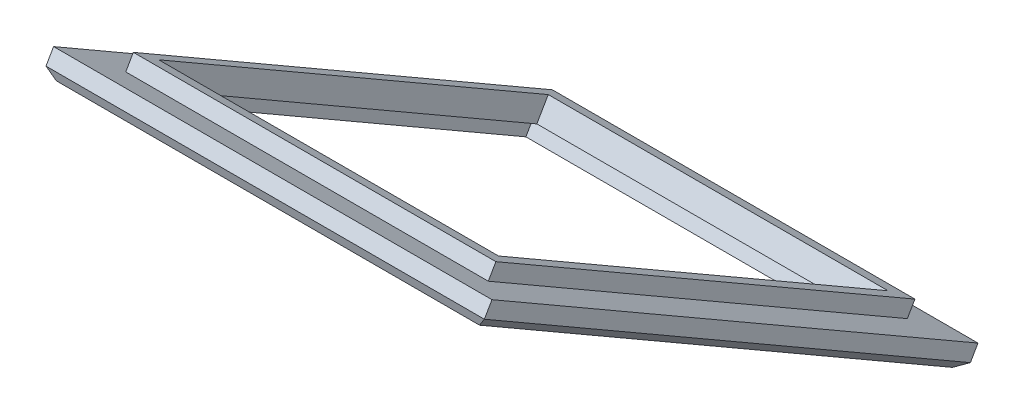
from build123d import *

# Parameters (mm, degrees)
SKETCH1_W           = 57.8
SKETCH1_H           = 74
SKETCH1_W_2         = 44.8
SKETCH1_H_2         = 59.3
BOSS_EXTRUDE1_DEPTH = 3
CHAMFER1_SIZE       = 1
SKETCH2_W           = 47.8
SKETCH2_H           = 63.8
SKETCH2_W_2         = 44.8
SKETCH2_H_2         = 59.3
BOSS_EXTRUDE2_DEPTH = 2
SKETCH4_W           = 48.2
SKETCH4_H           = 62.2
CUT_EXTRUDE1_DEPTH  = 2


with BuildPart() as part:
    # Sketch1 → Boss-Extrude1 (new body)
    with BuildSketch(Plane(origin=(0, -73.874274117, 42.651332047), x_dir=(1, 0, 0), z_dir=(0, -0.8660254037844363, 0.5000000000000041))):
        with Locations((2.02457026, 64.457304532)):
            Rectangle(SKETCH1_W, SKETCH1_H)
        with Locations((2.02457026, 64.457304532)):
            Rectangle(SKETCH1_W_2, SKETCH1_H_2, mode=Mode.SUBTRACT)
    extrude(amount=-BOSS_EXTRUDE1_DEPTH)

    # Chamfer1
    chamfer1_edges = [part.edges().sort_by_distance(p)[0] for p in [
        (-20.37542974, -41.645621851, 98.472995232),
        (2.02457026, -56.470621851, 72.795342009),
        (24.42457026, -41.645621851, 98.472995232),
        (2.02457026, -26.820621851, 124.150648454),
        (2.02457026, -23.145621851, 130.515935172),
        (30.92457026, -41.645621851, 98.472995232),
        (2.02457026, -60.145621851, 66.430055292),
        (-26.87542974, -41.645621851, 98.472995232),
    ]]
    chamfer(chamfer1_edges, length=CHAMFER1_SIZE)

    # Sketch2 → Boss-Extrude2 (add)
    with BuildSketch(Plane(origin=(0, -71.276197905, 41.151332047), x_dir=(-1, 0, 0), z_dir=(0, 0.8660254037844366, -0.5000000000000038))):
        with Locations((-2.12457026, 64.457304532)):
            Rectangle(SKETCH2_W, SKETCH2_H)
        with Locations((-2.02457026, 64.457304532)):
            Rectangle(SKETCH2_W_2, SKETCH2_H_2, mode=Mode.SUBTRACT)
    extrude(amount=BOSS_EXTRUDE2_DEPTH)

    # Sketch4 → Cut-Extrude1 (cut)
    with BuildSketch(Plane(origin=(0, -73.874274117, 42.651332047), x_dir=(1, 0, 0), z_dir=(0, -0.8660254037844366, 0.5000000000000038))):
        with Locations((2.02457026, 64.457304532)):
            Rectangle(SKETCH4_W, SKETCH4_H)
    extrude(amount=-CUT_EXTRUDE1_DEPTH, mode=Mode.SUBTRACT)


solid = part.part
